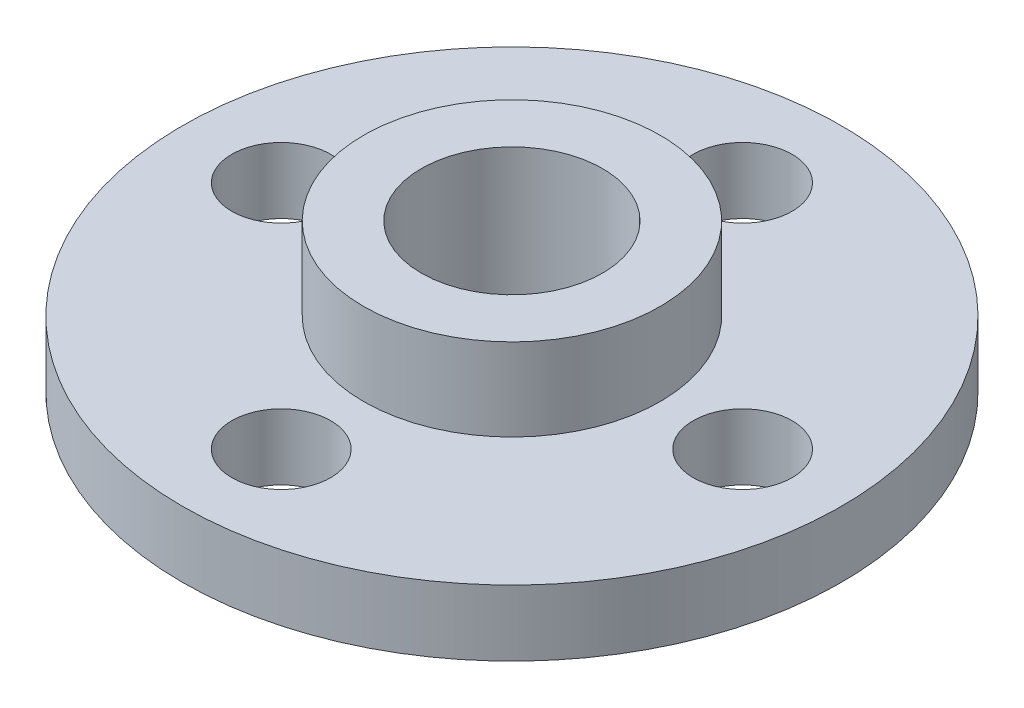
from build123d import *

# Parameters (mm, degrees)
SKETCH_1_R          = 10
SKETCH_1_R_2        = 1.5
EXTRUDE_1_DEPTH     = 2
SKETCH_2_R          = 4.5
SKETCH_2_R_2        = 2.75
EXTRUDE_2_DEPTH     = 2.5
SKETCH_3_R          = 2.75
CUT_EXTRUDE_1_DEPTH = 15.361406616


with BuildPart() as part:
    # 草图1 → 凸台-拉伸1 (new body)
    with BuildSketch(Plane(origin=(0, 0, 0), x_dir=(1, 0, 0), z_dir=(0, 1, 0))):
        with Locations(Location((0, 0, 0), (0, 0, 270))):
            Circle(SKETCH_1_R)
        with Locations(Location((0, 7, 0), (0, 0, 270))):
            Circle(SKETCH_1_R_2, mode=Mode.SUBTRACT)
        with Locations(Location((-7, 0, 0), (0, 0, 270))):
            Circle(SKETCH_1_R_2, mode=Mode.SUBTRACT)
        with Locations(Location((0, -7, 0), (0, 0, 270))):
            Circle(SKETCH_1_R_2, mode=Mode.SUBTRACT)
        with Locations(Location((7, 0, 0), (0, 0, 270))):
            Circle(SKETCH_1_R_2, mode=Mode.SUBTRACT)
    extrude(amount=EXTRUDE_1_DEPTH)

    # 草图2 → 凸台-拉伸2 (add)
    with BuildSketch(Plane(origin=(0, 2, 0), x_dir=(1, 0, 0), z_dir=(0, 1, 0))):
        with Locations(Location((0, 0, 0), (0, 0, 270))):
            Circle(SKETCH_2_R)
        with Locations(Location((0, 0, 0), (0, 0, 270))):
            Circle(SKETCH_2_R_2, mode=Mode.SUBTRACT)
    extrude(amount=EXTRUDE_2_DEPTH)

    # 草图3 → 切除-拉伸1 (cut, through all)
    with BuildSketch(Plane(origin=(0, 2, 0), x_dir=(1, 0, 0), z_dir=(0, 1, 0))):
        with Locations(Location((0, 0, 0), (0, 0, 270))):
            Circle(SKETCH_3_R)
    extrude(amount=-CUT_EXTRUDE_1_DEPTH, mode=Mode.SUBTRACT)


solid = part.part
